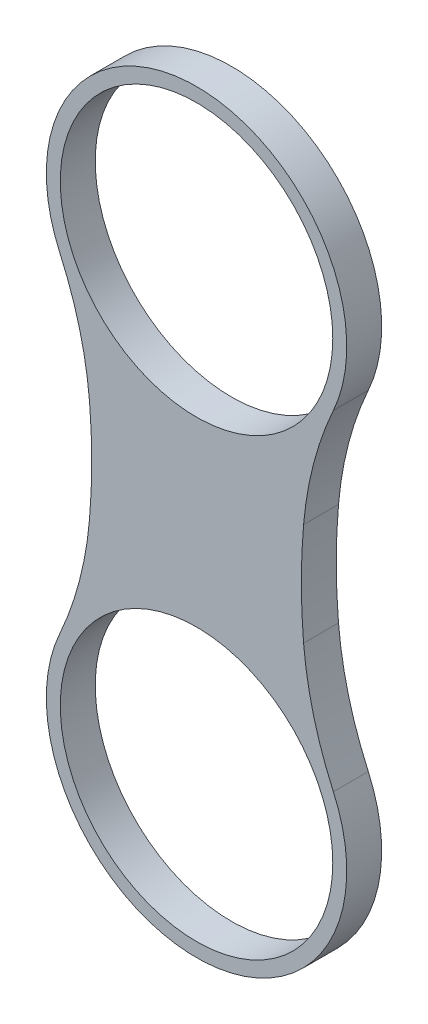
from build123d import *

# Parameters (mm, degrees)
SKETCH_1_R      = 3.9
EXTRUDE_1_DEPTH = 1


with BuildPart() as part:
    # Эскиз1 → Вытянуть1 (new body)
    with BuildSketch(Plane.XY):
        with BuildLine():
            ThreePointArc((3.91695076, -1.774118582), (0, 4.3), (-3.91695076, -1.774118582))
            ThreePointArc((-3.91695076, -1.774118582), (-3.352489907, -3.366100957), (-3.064020566, -5.030375386))
            ThreePointArc((-3.064020566, -5.030375386), (-3, -6.5), (-3.064020566, -7.969624614))
            ThreePointArc((-3.064020566, -7.969624614), (-3.352489907, -9.633899043), (-3.91695076, -11.225881418))
            ThreePointArc((-3.91695076, -11.225881418), (0, -17.3), (3.91695076, -11.225881418))
            ThreePointArc((3.91695076, -11.225881418), (3.352489907, -9.633899043), (3.064020566, -7.969624614))
            ThreePointArc((3.064020566, -7.969624614), (3, -6.5), (3.064020566, -5.030375386))
            ThreePointArc((3.064020566, -5.030375386), (3.352489907, -3.366100957), (3.91695076, -1.774118582))
        make_face()
        Circle(SKETCH_1_R, mode=Mode.SUBTRACT)
        with Locations((0, -13)):
            Circle(SKETCH_1_R, mode=Mode.SUBTRACT)
    extrude(amount=EXTRUDE_1_DEPTH)


solid = part.part
